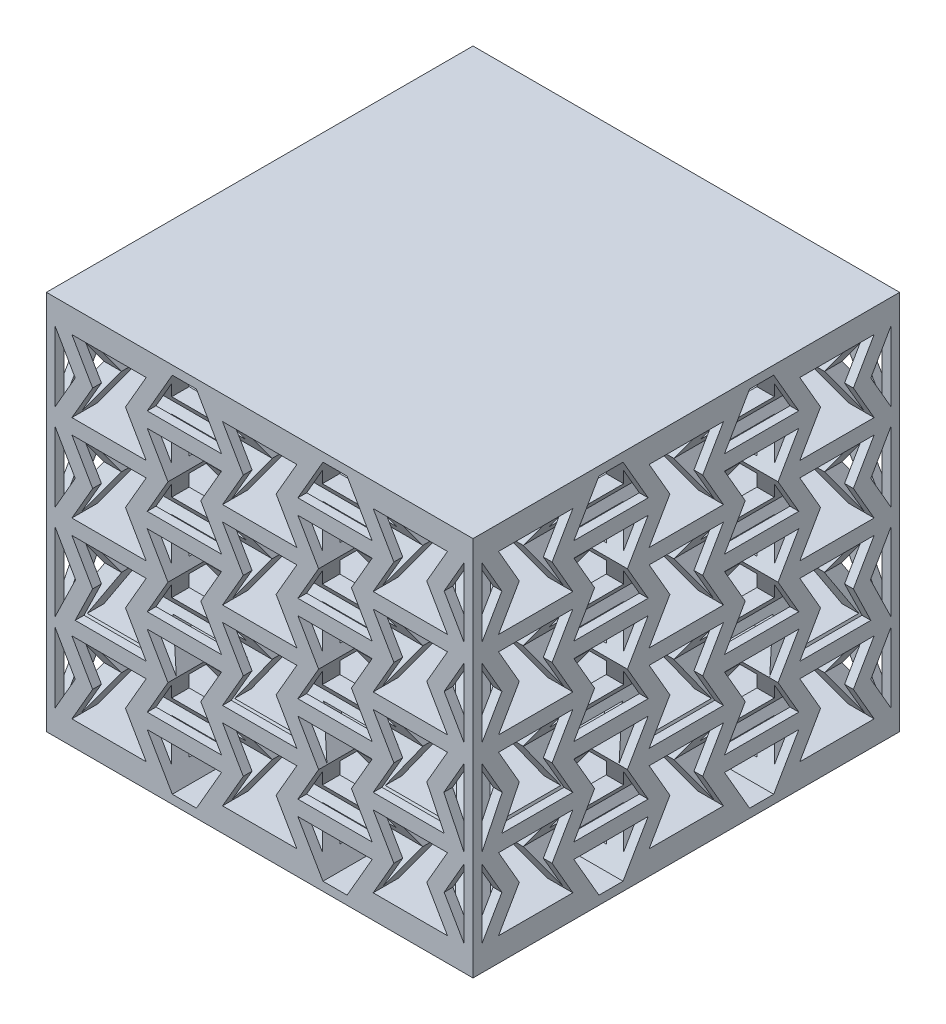
from build123d import *

# Parameters (mm, degrees)
SKETCH1_W           = 84.964101615
SKETCH1_H           = 75.782032303
BOSS_EXTRUDE1_DEPTH = 42.48
SKETCH2_OUTSIDE_W   = 115.372
SKETCH2_OUTSIDE_H   = 106.194
SKETCH2_OUTSIDE_W_2 = 84.964101615
SKETCH2_OUTSIDE_H_2 = 75.782032303
CUT_EXTRUDE3_DEPTH  = 115.806339376


with BuildPart() as part:
    # Sketch1 → Boss-Extrude1 (new, symmetric)
    with BuildSketch(Plane.XY):
        with Locations((30.402256252, -26.584146491)):
            Rectangle(SKETCH1_W, SKETCH1_H)
        Polygon((-6.999667537, -10.763638415), (7.80418004, -10.763638415), (3.670205444, -17.923892453), (7.80418004, -25.084146491), (-6.999667537, -25.084146491), (-2.865692941, -17.923892453), align=None, mode=Mode.SUBTRACT)
        Polygon((12.134307059, -9.263638415), (8.000332463, -2.103384377), (22.80418004, -2.103384377), (18.670205444, -9.263638415), (22.80418004, -16.423892453), (8.000332463, -16.423892453), align=None, mode=Mode.SUBTRACT)
        Polygon((8.000332463, 0.896615623), (13.000332463, 9.556869661), (17.80418004, 9.556869661), (22.80418004, 0.896615623), align=None, mode=Mode.SUBTRACT)
        Polygon((-10.329794556, 6.324818853), (-6.329794556, -0.603384377), (-10.329794556, -7.531587607), align=None, mode=Mode.SUBTRACT)
        Polygon((-10.329794556, -10.995689222), (-6.329794556, -17.923892453), (-10.329794556, -24.852095683), align=None, mode=Mode.SUBTRACT)
        Polygon((12.134307059, -26.584146491), (8.000332463, -19.423892453), (22.80418004, -19.423892453), (18.670205444, -26.584146491), (22.80418004, -33.744400528), (8.000332463, -33.744400528), align=None, mode=Mode.SUBTRACT)
        Polygon((-10.329794556, -28.316197298), (-6.259900219, -35.365461071), (-10.329794556, -43.741638793), align=None, mode=Mode.SUBTRACT)
        Polygon((12.134307059, -43.904654566), (8.000332463, -36.744400528), (22.80418004, -36.744400528), (18.670205444, -43.904654566), (22.80418004, -51.064908604), (8.000332463, -51.064908604), align=None, mode=Mode.SUBTRACT)
        Polygon((-10.329794556, -45.636705374), (-6.329794556, -52.564908604), (-10.329794556, -59.493111834), align=None, mode=Mode.SUBTRACT)
        Polygon((13.000332463, -62.725162642), (8.000332463, -54.064908604), (22.80418004, -54.064908604), (17.80418004, -62.725162642), align=None, mode=Mode.SUBTRACT)
        Polygon((38.000332463, -2.103384377), (52.80418004, -2.103384377), (48.670205444, -9.263638415), (52.80418004, -16.423892453), (38.000332463, -16.423892453), (42.134307059, -9.263638415), align=None, mode=Mode.SUBTRACT)
        Polygon((23.000332463, -10.763638415), (37.80418004, -10.763638415), (33.670205444, -17.923892453), (37.80418004, -25.084146491), (23.000332463, -25.084146491), (27.134307059, -17.923892453), align=None, mode=Mode.SUBTRACT)
        Polygon((38.000332463, 0.896615623), (43.000332463, 9.556869661), (47.80418004, 9.556869661), (52.80418004, 0.896615623), align=None, mode=Mode.SUBTRACT)
        Polygon((38.000332463, -33.744400528), (52.80418004, -33.744400528), (48.670205444, -26.584146491), (52.80418004, -19.423892453), (38.000332463, -19.423892453), (42.134307059, -26.584146491), align=None, mode=Mode.SUBTRACT)
        Polygon((38.000332463, -51.064908604), (52.80418004, -51.064908604), (48.670205444, -43.904654566), (52.80418004, -36.744400528), (38.000332463, -36.744400528), (42.134307059, -43.904654566), align=None, mode=Mode.SUBTRACT)
        Polygon((43.000332463, -62.725162642), (38.000332463, -54.064908604), (52.80418004, -54.064908604), (47.80418004, -62.725162642), align=None, mode=Mode.SUBTRACT)
        Polygon((71.134307059, -7.531587607), (67.134307059, -0.603384377), (71.134307059, 6.324818853), align=None, mode=Mode.SUBTRACT)
        Polygon((71.134307059, -24.852095683), (67.134307059, -17.923892453), (71.134307059, -10.995689222), align=None, mode=Mode.SUBTRACT)
        Polygon((71.134307059, -43.741638793), (67.064412722, -35.365461071), (71.134307059, -28.316197298), align=None, mode=Mode.SUBTRACT)
        Polygon((71.134307059, -59.493111834), (67.134307059, -52.564908604), (71.134307059, -45.636705374), align=None, mode=Mode.SUBTRACT)
        Polygon((-6.999667537, -7.763638415), (7.80418004, -7.763638415), (3.670205444, -0.603384377), (7.80418004, 6.556869661), (-6.999667537, 6.556869661), (-2.865692941, -0.603384377), align=None, mode=Mode.SUBTRACT)
        Polygon((-6.999667537, -28.084146491), (-2.865692941, -35.244400528), (-6.344783086, -42.404654566), (7.80418004, -42.404654566), (3.670205444, -35.244400528), (7.80418004, -28.084146491), align=None, mode=Mode.SUBTRACT)
        Polygon((-6.999667537, -45.404654566), (-2.865692941, -52.564908604), (-6.999667537, -59.725162642), (7.80418004, -59.725162642), (3.670205444, -52.564908604), (7.80418004, -45.404654566), align=None, mode=Mode.SUBTRACT)
        Polygon((23.000332463, -7.763638415), (37.80418004, -7.763638415), (33.670205444, -0.603384377), (37.80418004, 6.556869661), (23.000332463, 6.556869661), (27.134307059, -0.603384377), align=None, mode=Mode.SUBTRACT)
        Polygon((23.000332463, -28.084146491), (27.134307059, -35.244400528), (23.000332463, -42.404654566), (37.80418004, -42.404654566), (33.670205444, -35.244400528), (37.80418004, -28.084146491), align=None, mode=Mode.SUBTRACT)
        Polygon((23.000332463, -45.404654566), (27.134307059, -52.564908604), (23.000332463, -59.725162642), (37.80418004, -59.725162642), (33.670205444, -52.564908604), (37.80418004, -45.404654566), align=None, mode=Mode.SUBTRACT)
        Polygon((53.000332463, -7.763638415), (67.80418004, -7.763638415), (63.670205444, -0.603384377), (67.80418004, 6.556869661), (53.000332463, 6.556869661), (57.134307059, -0.603384377), align=None, mode=Mode.SUBTRACT)
        Polygon((53.000332463, -10.763638415), (57.134307059, -17.923892453), (53.000332463, -25.084146491), (67.80418004, -25.084146491), (63.670205444, -17.923892453), (67.80418004, -10.763638415), align=None, mode=Mode.SUBTRACT)
        Polygon((53.000332463, -28.084146491), (57.134307059, -35.244400528), (53.000332463, -42.404654566), (67.149295589, -42.404654566), (63.670205444, -35.244400528), (67.80418004, -28.084146491), align=None, mode=Mode.SUBTRACT)
        Polygon((53.000332463, -45.404654566), (57.134307059, -52.564908604), (53.000332463, -59.725162642), (67.80418004, -59.725162642), (63.670205444, -52.564908604), (67.80418004, -45.404654566), align=None, mode=Mode.SUBTRACT)
    extrude(amount=BOSS_EXTRUDE1_DEPTH, both=True)

    # Sketch2 outside → Cut-Extrude3 (cut, through all)
    # profile 1 of 31: a face of its own
    with BuildSketch(Plane(origin=(72.884307059, 0, 0), x_dir=(0, 0, -1), z_dir=(1, 0, 0))):
        with Locations((0, -26.584)):
            Rectangle(SKETCH2_OUTSIDE_W, SKETCH2_OUTSIDE_H)
        with Locations((0.002050807, -26.584146491)):
            Rectangle(SKETCH2_OUTSIDE_W_2, SKETCH2_OUTSIDE_H_2, mode=Mode.SUBTRACT)
    # profile 2 of 31: a face of its own
    with BuildSketch(Plane(origin=(72.884307059, 0, 0), x_dir=(0, 0, -1), z_dir=(1, 0, 0))):
        Polygon((-37.399872981, -10.763638415), (-22.596025404, -10.763638415), (-26.73, -17.923892453), (-22.596025404, -25.084146491), (-37.399872981, -25.084146491), (-33.265898385, -17.923892453), align=None)
    # profile 3 of 31: a face of its own
    with BuildSketch(Plane(origin=(72.884307059, 0, 0), x_dir=(0, 0, -1), z_dir=(1, 0, 0))):
        Polygon((-18.265898385, -9.263638415), (-22.399872981, -2.103384377), (-7.596025404, -2.103384377), (-11.73, -9.263638415), (-7.596025404, -16.423892453), (-22.399872981, -16.423892453), align=None)
    # profile 4 of 31: a face of its own
    with BuildSketch(Plane(origin=(72.884307059, 0, 0), x_dir=(0, 0, -1), z_dir=(1, 0, 0))):
        Polygon((-22.399872981, 0.896615623), (-17.399872981, 9.556869661), (-12.596025404, 9.556869661), (-7.596025404, 0.896615623), align=None)
    # profile 5 of 31: a face of its own
    with BuildSketch(Plane(origin=(72.884307059, 0, 0), x_dir=(0, 0, -1), z_dir=(1, 0, 0))):
        Polygon((-40.73, 6.324818853), (-36.73, -0.603384377), (-40.73, -7.531587607), align=None)
    # profile 6 of 31: a face of its own
    with BuildSketch(Plane(origin=(72.884307059, 0, 0), x_dir=(0, 0, -1), z_dir=(1, 0, 0))):
        Polygon((-40.73, -10.995689222), (-36.73, -17.923892453), (-40.73, -24.852095683), align=None)
    # profile 7 of 31: a face of its own
    with BuildSketch(Plane(origin=(72.884307059, 0, 0), x_dir=(0, 0, -1), z_dir=(1, 0, 0))):
        Polygon((-18.265898385, -26.584146491), (-22.399872981, -19.423892453), (-7.596025404, -19.423892453), (-11.73, -26.584146491), (-7.596025404, -33.744400528), (-22.399872981, -33.744400528), align=None)
    # profile 8 of 31: a face of its own
    with BuildSketch(Plane(origin=(72.884307059, 0, 0), x_dir=(0, 0, -1), z_dir=(1, 0, 0))):
        Polygon((-40.73, -28.316197298), (-36.660105663, -35.365461071), (-40.73, -43.741638793), align=None)
    # profile 9 of 31: a face of its own
    with BuildSketch(Plane(origin=(72.884307059, 0, 0), x_dir=(0, 0, -1), z_dir=(1, 0, 0))):
        Polygon((-18.265898385, -43.904654566), (-22.399872981, -36.744400528), (-7.596025404, -36.744400528), (-11.73, -43.904654566), (-7.596025404, -51.064908604), (-22.399872981, -51.064908604), align=None)
    # profile 10 of 31: a face of its own
    with BuildSketch(Plane(origin=(72.884307059, 0, 0), x_dir=(0, 0, -1), z_dir=(1, 0, 0))):
        Polygon((-40.73, -45.636705374), (-36.73, -52.564908604), (-40.73, -59.493111834), align=None)
    # profile 11 of 31: a face of its own
    with BuildSketch(Plane(origin=(72.884307059, 0, 0), x_dir=(0, 0, -1), z_dir=(1, 0, 0))):
        Polygon((-17.399872981, -62.725162642), (-22.399872981, -54.064908604), (-7.596025404, -54.064908604), (-12.596025404, -62.725162642), align=None)
    # profile 12 of 31: a face of its own
    with BuildSketch(Plane(origin=(72.884307059, 0, 0), x_dir=(0, 0, -1), z_dir=(1, 0, 0))):
        Polygon((7.600127019, -2.103384377), (22.403974596, -2.103384377), (18.27, -9.263638415), (22.403974596, -16.423892453), (7.600127019, -16.423892453), (11.734101615, -9.263638415), align=None)
    # profile 13 of 31: a face of its own
    with BuildSketch(Plane(origin=(72.884307059, 0, 0), x_dir=(0, 0, -1), z_dir=(1, 0, 0))):
        Polygon((-7.399872981, -10.763638415), (7.403974596, -10.763638415), (3.27, -17.923892453), (7.403974596, -25.084146491), (-7.399872981, -25.084146491), (-3.265898385, -17.923892453), align=None)
    # profile 14 of 31: a face of its own
    with BuildSketch(Plane(origin=(72.884307059, 0, 0), x_dir=(0, 0, -1), z_dir=(1, 0, 0))):
        Polygon((7.600127019, 0.896615623), (12.600127019, 9.556869661), (17.403974596, 9.556869661), (22.403974596, 0.896615623), align=None)
    # profile 15 of 31: a face of its own
    with BuildSketch(Plane(origin=(72.884307059, 0, 0), x_dir=(0, 0, -1), z_dir=(1, 0, 0))):
        Polygon((7.600127019, -33.744400528), (22.403974596, -33.744400528), (18.27, -26.584146491), (22.403974596, -19.423892453), (7.600127019, -19.423892453), (11.734101615, -26.584146491), align=None)
    # profile 16 of 31: a face of its own
    with BuildSketch(Plane(origin=(72.884307059, 0, 0), x_dir=(0, 0, -1), z_dir=(1, 0, 0))):
        Polygon((7.600127019, -51.064908604), (22.403974596, -51.064908604), (18.27, -43.904654566), (22.403974596, -36.744400528), (7.600127019, -36.744400528), (11.734101615, -43.904654566), align=None)
    # profile 17 of 31: a face of its own
    with BuildSketch(Plane(origin=(72.884307059, 0, 0), x_dir=(0, 0, -1), z_dir=(1, 0, 0))):
        Polygon((12.600127019, -62.725162642), (7.600127019, -54.064908604), (22.403974596, -54.064908604), (17.403974596, -62.725162642), align=None)
    # profile 18 of 31: a face of its own
    with BuildSketch(Plane(origin=(72.884307059, 0, 0), x_dir=(0, 0, -1), z_dir=(1, 0, 0))):
        Polygon((40.734101615, -7.531587607), (36.734101615, -0.603384377), (40.734101615, 6.324818853), align=None)
    # profile 19 of 31: a face of its own
    with BuildSketch(Plane(origin=(72.884307059, 0, 0), x_dir=(0, 0, -1), z_dir=(1, 0, 0))):
        Polygon((40.734101615, -24.852095683), (36.734101615, -17.923892453), (40.734101615, -10.995689222), align=None)
    # profile 20 of 31: a face of its own
    with BuildSketch(Plane(origin=(72.884307059, 0, 0), x_dir=(0, 0, -1), z_dir=(1, 0, 0))):
        Polygon((40.734101615, -43.741638793), (36.664207278, -35.365461071), (40.734101615, -28.316197298), align=None)
    # profile 21 of 31: a face of its own
    with BuildSketch(Plane(origin=(72.884307059, 0, 0), x_dir=(0, 0, -1), z_dir=(1, 0, 0))):
        Polygon((40.734101615, -59.493111834), (36.734101615, -52.564908604), (40.734101615, -45.636705374), align=None)
    # profile 22 of 31: a face of its own
    with BuildSketch(Plane(origin=(72.884307059, 0, 0), x_dir=(0, 0, -1), z_dir=(1, 0, 0))):
        Polygon((-37.399872981, -7.763638415), (-22.596025404, -7.763638415), (-26.73, -0.603384377), (-22.596025404, 6.556869661), (-37.399872981, 6.556869661), (-33.265898385, -0.603384377), align=None)
    # profile 23 of 31: a face of its own
    with BuildSketch(Plane(origin=(72.884307059, 0, 0), x_dir=(0, 0, -1), z_dir=(1, 0, 0))):
        Polygon((-37.399872981, -28.084146491), (-33.265898385, -35.244400528), (-36.74498853, -42.404654566), (-22.596025404, -42.404654566), (-26.73, -35.244400528), (-22.596025404, -28.084146491), align=None)
    # profile 24 of 31: a face of its own
    with BuildSketch(Plane(origin=(72.884307059, 0, 0), x_dir=(0, 0, -1), z_dir=(1, 0, 0))):
        Polygon((-37.399872981, -45.404654566), (-33.265898385, -52.564908604), (-37.399872981, -59.725162642), (-22.596025404, -59.725162642), (-26.73, -52.564908604), (-22.596025404, -45.404654566), align=None)
    # profile 25 of 31: a face of its own
    with BuildSketch(Plane(origin=(72.884307059, 0, 0), x_dir=(0, 0, -1), z_dir=(1, 0, 0))):
        Polygon((-7.399872981, -7.763638415), (7.403974596, -7.763638415), (3.27, -0.603384377), (7.403974596, 6.556869661), (-7.399872981, 6.556869661), (-3.265898385, -0.603384377), align=None)
    # profile 26 of 31: a face of its own
    with BuildSketch(Plane(origin=(72.884307059, 0, 0), x_dir=(0, 0, -1), z_dir=(1, 0, 0))):
        Polygon((-7.399872981, -28.084146491), (-3.265898385, -35.244400528), (-7.399872981, -42.404654566), (7.403974596, -42.404654566), (3.27, -35.244400528), (7.403974596, -28.084146491), align=None)
    # profile 27 of 31: a face of its own
    with BuildSketch(Plane(origin=(72.884307059, 0, 0), x_dir=(0, 0, -1), z_dir=(1, 0, 0))):
        Polygon((-7.399872981, -45.404654566), (-3.265898385, -52.564908604), (-7.399872981, -59.725162642), (7.403974596, -59.725162642), (3.27, -52.564908604), (7.403974596, -45.404654566), align=None)
    # profile 28 of 31: a face of its own
    with BuildSketch(Plane(origin=(72.884307059, 0, 0), x_dir=(0, 0, -1), z_dir=(1, 0, 0))):
        Polygon((22.600127019, -7.763638415), (37.403974596, -7.763638415), (33.27, -0.603384377), (37.403974596, 6.556869661), (22.600127019, 6.556869661), (26.734101615, -0.603384377), align=None)
    # profile 29 of 31: a face of its own
    with BuildSketch(Plane(origin=(72.884307059, 0, 0), x_dir=(0, 0, -1), z_dir=(1, 0, 0))):
        Polygon((22.600127019, -10.763638415), (26.734101615, -17.923892453), (22.600127019, -25.084146491), (37.403974596, -25.084146491), (33.27, -17.923892453), (37.403974596, -10.763638415), align=None)
    # profile 30 of 31: a face of its own
    with BuildSketch(Plane(origin=(72.884307059, 0, 0), x_dir=(0, 0, -1), z_dir=(1, 0, 0))):
        Polygon((22.600127019, -28.084146491), (26.734101615, -35.244400528), (22.600127019, -42.404654566), (36.749090145, -42.404654566), (33.27, -35.244400528), (37.403974596, -28.084146491), align=None)
    # profile 31 of 31: a face of its own
    with BuildSketch(Plane(origin=(72.884307059, 0, 0), x_dir=(0, 0, -1), z_dir=(1, 0, 0))):
        Polygon((22.600127019, -45.404654566), (26.734101615, -52.564908604), (22.600127019, -59.725162642), (37.403974596, -59.725162642), (33.27, -52.564908604), (37.403974596, -45.404654566), align=None)
    extrude(amount=-CUT_EXTRUDE3_DEPTH, mode=Mode.SUBTRACT)


solid = part.part
